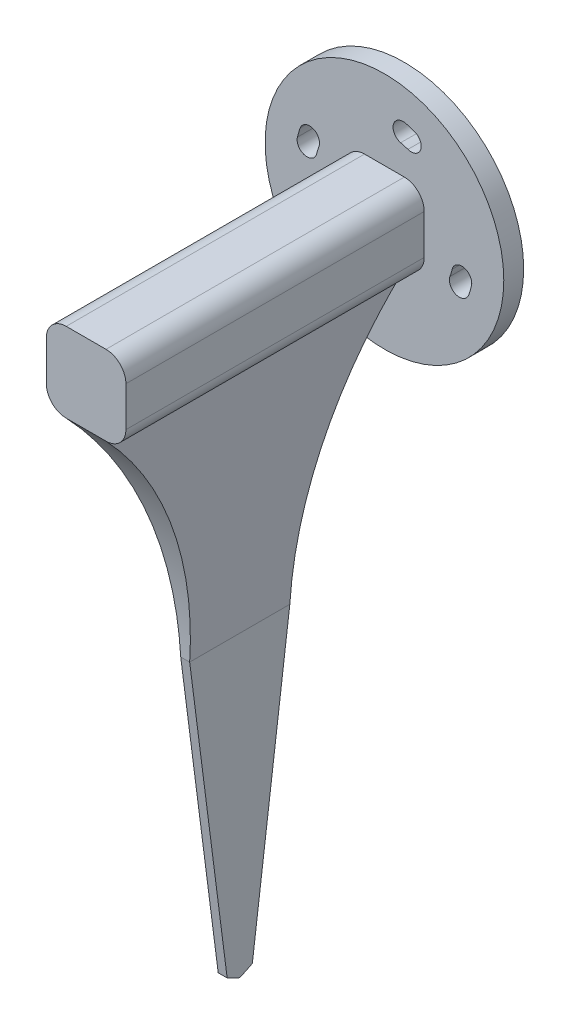
from build123d import *

# Parameters (mm, degrees)
ESQUISSE1_R             = 12
BOSS_EXTRU_1_DEPTH      = 2
BOSS_EXTRU_2_DEPTH      = 30
BOSS_EXTRU_3_DEPTH      = 0.45
ENL_V_MAT_EXTRU_1_REACH = 71


with BuildPart() as part:
    # Esquisse1 → Boss.-Extru.1 (new body)
    with BuildSketch(Plane.XY):
        Circle(ESQUISSE1_R)
        with BuildLine():
            ThreePointArc((-8.473394023, 3.033412884), (-8.624994546, 2.570888774), (-8.751368421, 2.10084525))
            ThreePointArc((-8.751368421, 2.10084525), (-8.012421402, 0.895043731), (-6.806619883, 1.63399075))
            ThreePointArc((-6.806619883, 1.63399075), (-6.708329091, 1.999580157), (-6.590417574, 2.359321132))
            ThreePointArc((-6.590417574, 2.359321132), (-7.194859923, 3.637855233), (-8.473394023, 3.033412884))
        make_face(mode=Mode.SUBTRACT)
        with BuildLine():
            ThreePointArc((3.033412884, 8.473394023), (2.570888774, 8.624994546), (2.10084525, 8.751368421))
            ThreePointArc((2.10084525, 8.751368421), (0.895043731, 8.012421402), (1.63399075, 6.806619883))
            ThreePointArc((1.63399075, 6.806619883), (1.999580157, 6.708329091), (2.359321132, 6.590417574))
            ThreePointArc((2.359321132, 6.590417574), (3.637855233, 7.194859923), (3.033412884, 8.473394023))
        make_face(mode=Mode.SUBTRACT)
        with BuildLine():
            ThreePointArc((8.473394023, -3.033412884), (8.624994546, -2.570888774), (8.751368421, -2.10084525))
            ThreePointArc((8.751368421, -2.10084525), (8.012421402, -0.895043731), (6.806619883, -1.63399075))
            ThreePointArc((6.806619883, -1.63399075), (6.708329091, -1.999580157), (6.590417574, -2.359321132))
            ThreePointArc((6.590417574, -2.359321132), (7.194859923, -3.637855233), (8.473394023, -3.033412884))
        make_face(mode=Mode.SUBTRACT)
        with BuildLine():
            ThreePointArc((-3.033412884, -8.473394023), (-2.570888774, -8.624994546), (-2.10084525, -8.751368421))
            ThreePointArc((-2.10084525, -8.751368421), (-0.895043731, -8.012421402), (-1.63399075, -6.806619883))
            ThreePointArc((-1.63399075, -6.806619883), (-1.999580157, -6.708329091), (-2.359321132, -6.590417574))
            ThreePointArc((-2.359321132, -6.590417574), (-3.637855233, -7.194859923), (-3.033412884, -8.473394023))
        make_face(mode=Mode.SUBTRACT)
    extrude(amount=BOSS_EXTRU_1_DEPTH)

    # Esquisse2 → Boss.-Extru.2 (add)
    with BuildSketch(Plane.XY.offset(2)):
        with BuildLine():
            Line((-2, 4), (2, 4))
            ThreePointArc((2, 4), (3.414213562, 3.414213562), (4, 2))
            Line((4, 2), (4, -2))
            ThreePointArc((4, -2), (3.414213562, -3.414213562), (2, -4))
            Line((2, -4), (-2, -4))
            ThreePointArc((-2, -4), (-3.414213562, -3.414213562), (-4, -2))
            Line((-4, -2), (-4, 2))
            ThreePointArc((-4, 2), (-3.414213562, 3.414213562), (-2, 4))
        make_face()
    extrude(amount=BOSS_EXTRU_2_DEPTH)


with BuildPart() as body_2:
    # Esquisse3 → Boss.-Extru.3 (new, symmetric)
    with BuildSketch(Plane(origin=(0, 0, 0), x_dir=(0, 0, -1), z_dir=(1, 0, 0))):
        with BuildLine():
            Line((-11.963767642, -29), (-22.036232358, -29))
            Line((-22.036232358, -29), (-18.266617818, -58.387853285))
            ThreePointArc((-18.266617818, -58.387853285), (-17.638228926, -58.70410685), (-17, -59))
            ThreePointArc((-17, -59), (-16.361771074, -58.70410685), (-15.733382182, -58.387853285))
            Line((-15.733382182, -58.387853285), (-11.963767642, -29))
        make_face()
    extrude(amount=BOSS_EXTRU_3_DEPTH, both=True)


    add(part.part)  # lissage1 joins it to this body
    # loft from a face of the part (lissage1)
    loft([body_2.faces().sort_by_distance((0, -29, 17))[0], body_2.faces().sort_by_distance((0, -4, 17))[0]])

    # Enlèv. mat.-Extru.1: up to this plane
    enl_v_mat_extru_1_end = Plane(origin=(-2.239391778, -0.13884229, 0), z_dir=(-0.998083523435423, -0.061881178452996184, 0))
    # Esquisse5 → Enlèv. mat.-Extru.1 (cut, up to the surface)
    with BuildSketch(Plane.ZY.offset(-4), mode=Mode.PRIVATE) as enl_v_mat_extru_1_sk1:
        with BuildLine():
            ThreePointArc((32, -4), (24.618937512, -15.543805649), (22.036232358, -29))
            Line((22.036232358, -29), (32, -4))
        make_face()
    enl_v_mat_extru_1_tool1 = split(extrude(enl_v_mat_extru_1_sk1.sketch, amount=ENL_V_MAT_EXTRU_1_REACH, mode=Mode.PRIVATE), bisect_by=enl_v_mat_extru_1_end, keep=Keep.BOTH, mode=Mode.PRIVATE)
    add(enl_v_mat_extru_1_tool1.solids().sort_by_distance((4, -16.116333, 26.055461))[0], mode=Mode.SUBTRACT)
    # Esquisse5 → Enlèv. mat.-Extru.1 (cut, up to the surface)
    with BuildSketch(Plane.ZY.offset(-4), mode=Mode.PRIVATE) as enl_v_mat_extru_1_sk2:
        with BuildLine():
            Line((32, -4), (22.036232358, -29))
            ThreePointArc((22.036232358, -29), (58.381754034, -65.345521676), (94.727275711, -29))
            ThreePointArc((94.727275711, -29), (71.837948385, 4.762816522), (32, -4))
        make_face()
    enl_v_mat_extru_1_tool2 = split(extrude(enl_v_mat_extru_1_sk2.sketch, amount=ENL_V_MAT_EXTRU_1_REACH, mode=Mode.PRIVATE), bisect_by=enl_v_mat_extru_1_end, keep=Keep.BOTH, mode=Mode.PRIVATE)
    add(enl_v_mat_extru_1_tool2.solids().sort_by_distance((4, -29.146557, 58.74948))[0], mode=Mode.SUBTRACT)
    # Esquisse5 → Enlèv. mat.-Extru.1 (cut, up to the surface)
    with BuildSketch(Plane.ZY.offset(-4), mode=Mode.PRIVATE) as enl_v_mat_extru_1_sk3:
        with BuildLine():
            Line((2, -4), (11.963767642, -29))
            ThreePointArc((11.963767642, -29), (9.381062488, -15.543805649), (2, -4))
        make_face()
    enl_v_mat_extru_1_tool3 = split(extrude(enl_v_mat_extru_1_sk3.sketch, amount=ENL_V_MAT_EXTRU_1_REACH, mode=Mode.PRIVATE), bisect_by=enl_v_mat_extru_1_end, keep=Keep.BOTH, mode=Mode.PRIVATE)
    add(enl_v_mat_extru_1_tool3.solids().sort_by_distance((4, -16.116333, 7.944539))[0], mode=Mode.SUBTRACT)


solid = body_2.part
